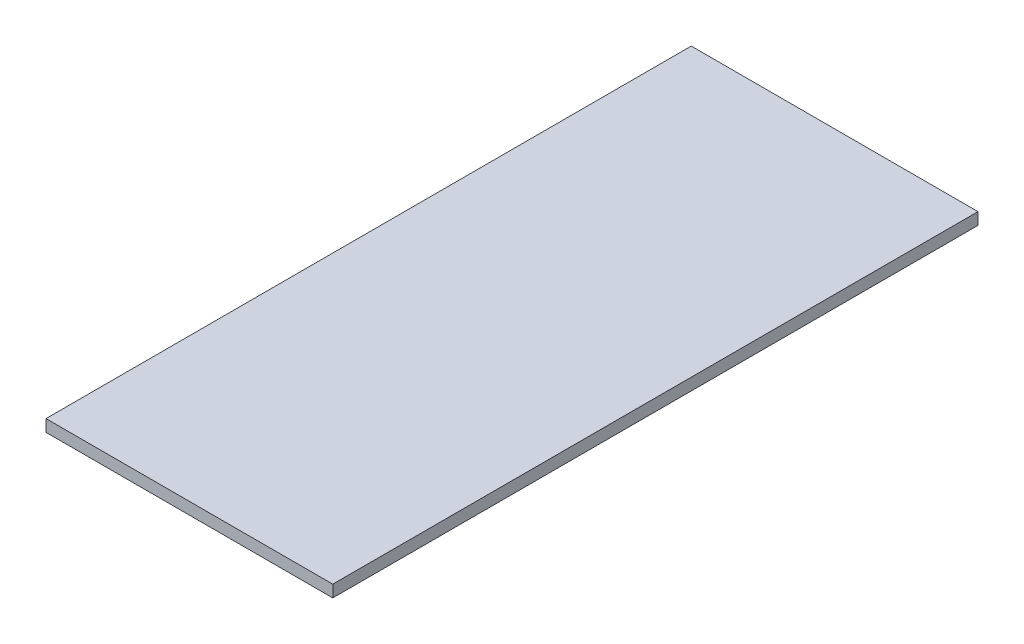
from build123d import *

# Parameters (mm, degrees)
SKETCH1_W           = 120
SKETCH1_H           = 270
BOSS_EXTRUDE1_DEPTH = 5


with BuildPart() as part:
    # Sketch1 → Boss-Extrude1 (new body)
    with BuildSketch(Plane(origin=(0, 0, 0), x_dir=(1, 0, 0), z_dir=(0, 1, 0))):
        with Locations((60, 135)):
            Rectangle(SKETCH1_W, SKETCH1_H)
    extrude(amount=BOSS_EXTRUDE1_DEPTH)


solid = part.part
